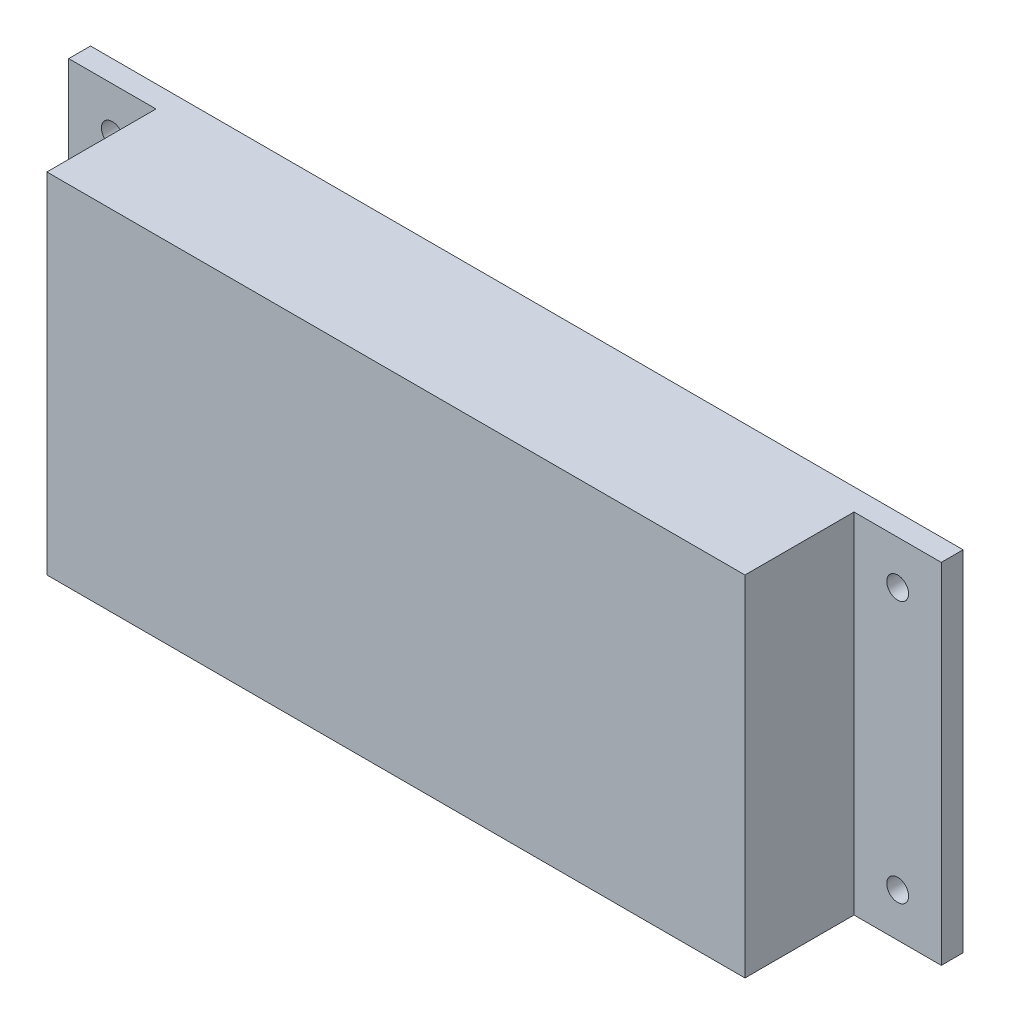
from build123d import *

# Parameters (mm, degrees)
SKETCH_1_W             = 200
SKETCH_1_H             = 80
EXTRUDE_1_DEPTH        = 5
SKETCH_2_W             = 160
SKETCH_2_H             = 80
EXTRUDE_2_DEPTH        = 25
CUT_EXTRUDE_START      = -5
SKETCH_3_W             = 150
SKETCH_3_H             = 65
CUT_EXTRUDE_1_DEPTH    = 20
HOLE_WIZARD_M6_1_D     = 5
HOLE_WIZARD_M6_1_DEPTH = 15
HOLE_WIZARD_M6_1_TIP   = 1.502151548


with BuildPart() as part:
    # 草图1 → 凸台-拉伸1 (new body)
    with BuildSketch(Plane.XY):
        Rectangle(SKETCH_1_W, SKETCH_1_H)
    extrude(amount=EXTRUDE_1_DEPTH)

    # 草图2 → 凸台-拉伸2 (add)
    with BuildSketch(Plane.XY.offset(5)):
        Rectangle(SKETCH_2_W, SKETCH_2_H)
    extrude(amount=EXTRUDE_2_DEPTH)

    # 草图3 → 切除-拉伸1 (cut)
    with BuildSketch(Plane.XY.offset(30).offset(CUT_EXTRUDE_START)):
        Rectangle(SKETCH_3_W, SKETCH_3_H)
    extrude(amount=-CUT_EXTRUDE_1_DEPTH, mode=Mode.SUBTRACT)

    # M6 螺纹孔1
    with Locations(Plane.XY.offset(5)):
        with Locations((-90, 30), (-90, -30), (90, 30), (90, -30)):
            Hole(HOLE_WIZARD_M6_1_D / 2, depth=HOLE_WIZARD_M6_1_DEPTH)
            with Locations((0, 0, -(HOLE_WIZARD_M6_1_DEPTH + HOLE_WIZARD_M6_1_TIP / 2))):  # 118° drill point
                Cone(0, HOLE_WIZARD_M6_1_D / 2, HOLE_WIZARD_M6_1_TIP, mode=Mode.SUBTRACT)


solid = part.part
